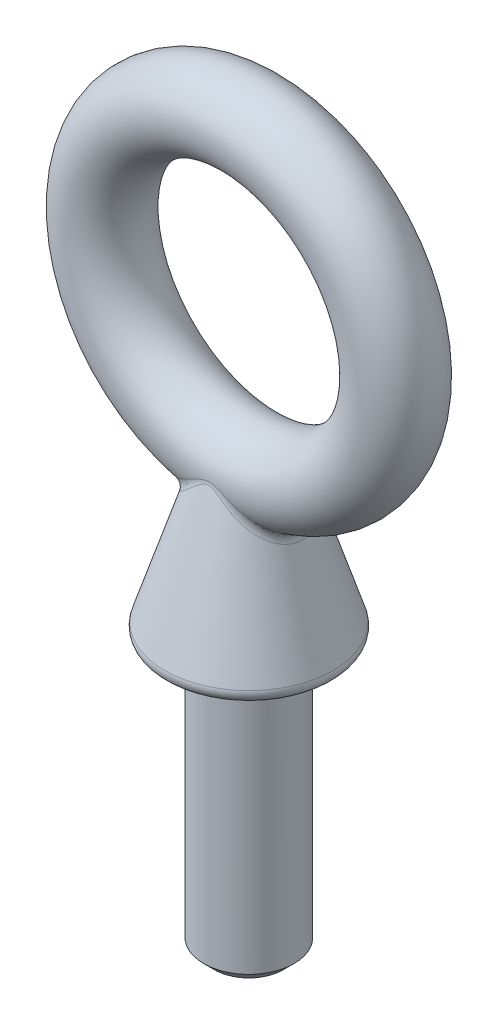
from build123d import *
from build123d.topology import SkipClean

# Parameters (mm, degrees)
BOSS_EXTRUDE1_START = -42.06875
SKETCH2_R           = 6.35
BOSS_EXTRUDE1_DEPTH = 38.1
SKETCH5_OUTSIDE_W   = 103.412
SKETCH5_OUTSIDE_H   = 103.412
SKETCH5_OUTSIDE_R   = 4.869429646
CUT_EXTRUDE1_DEPTH  = 40.144028919
CUT_EXTRUDE1_DRAFT  = -45
SKETCH6_R           = 5.55625
FILLET1_R           = 1.3890625


with BuildPart() as part:
    # Sketch2 → Boss-Extrude1 (new body)
    with BuildSketch(Plane(origin=(0, 0, 0), x_dir=(1, 0, 0), z_dir=(0, 1, 0)).offset(BOSS_EXTRUDE1_START)):
        with Locations(Location((0, 0, 0), (0, 0, 270))):
            Circle(SKETCH2_R)
    extrude(amount=-BOSS_EXTRUDE1_DEPTH)


with BuildPart() as cut_extrude1_tool:
    # Sketch5 outside → Cut-Extrude1 (with draft: the straight prism first)
    with BuildSketch(Plane.XZ.offset(80.16875)):
        Rectangle(SKETCH5_OUTSIDE_W, SKETCH5_OUTSIDE_H)
        Circle(SKETCH5_OUTSIDE_R, mode=Mode.SUBTRACT)
    extrude(amount=-CUT_EXTRUDE1_DEPTH)
    # Cut-Extrude1: the draft: its side faces are tilted about the plane it starts from
    cut_extrude1_sides = [cut_extrude1_tool.faces().sort_by_distance(p)[0] for p in [
        (0, -60.096735541, -51.706),
        (51.706, -60.096735541, 0),
        (0, -60.096735541, 51.706),
        (-51.706, -60.096735541, 0),
        (-4.869429646, -60.096735541, 0),
    ]]
    draft(cut_extrude1_sides, Plane.XZ.offset(80.16875), CUT_EXTRUDE1_DRAFT)


with BuildPart() as part_1:
    add(part.part)

    # Cut-Extrude1: cut by cut_extrude1_tool
    add(cut_extrude1_tool.part, mode=Mode.SUBTRACT)



with BuildPart() as body_2:
    # Sketch6 → Revolve1 (revolve)
    with BuildSketch(Plane(origin=(0, 0, 0), x_dir=(0, 0, -1), z_dir=(1, 0, 0)), mode=Mode.PRIVATE) as revolve1_sk:
        with Locations((0, 20.6375)):
            Circle(SKETCH6_R)
    revolve(revolve1_sk.sketch.rotate(Axis((0, 0, -7.63984375), (0, 0, 1)), 90), axis=Axis((0, 0, -7.63984375), (0, 0, 1)))


with BuildPart() as part_2:
    with SkipClean():  # the faces are left unmerged after this step: merging them gives an invalid solid
        add(part_1.part)

        add(body_2.part)  # Revolve2 merges body 2
        # Sketch8 → Revolve2 (revolve)
        with BuildSketch(Plane.XY, mode=Mode.PRIVATE) as revolve2_sk:
            with BuildLine():
                Line((0, -42.06875), (0, -20.6375))
                Line((0, -20.6375), (-5.55625, -20.6375))
                Line((-5.55625, -20.6375), (-11.840048893, -40.255974903))
                ThreePointArc((-11.840048893, -40.255974903), (-11.639252094, -41.498507184), (-10.5171875, -42.06875))
                Line((-10.5171875, -42.06875), (0, -42.06875))
            make_face()
        revolve(revolve2_sk.sketch.rotate(Axis((0, -42.06875, 0), (0, 1, 0)), 270), axis=Axis((0, -42.06875, 0), (0, 1, 0)))

    # Fillet1
    fillet1_edges = [part_2.edges().sort_by_distance(p)[0] for p in [
        (7.028263616, -25.233233039, 8.994e-06),
    ]]
    fillet(fillet1_edges, radius=FILLET1_R)


solid = part_2.part
